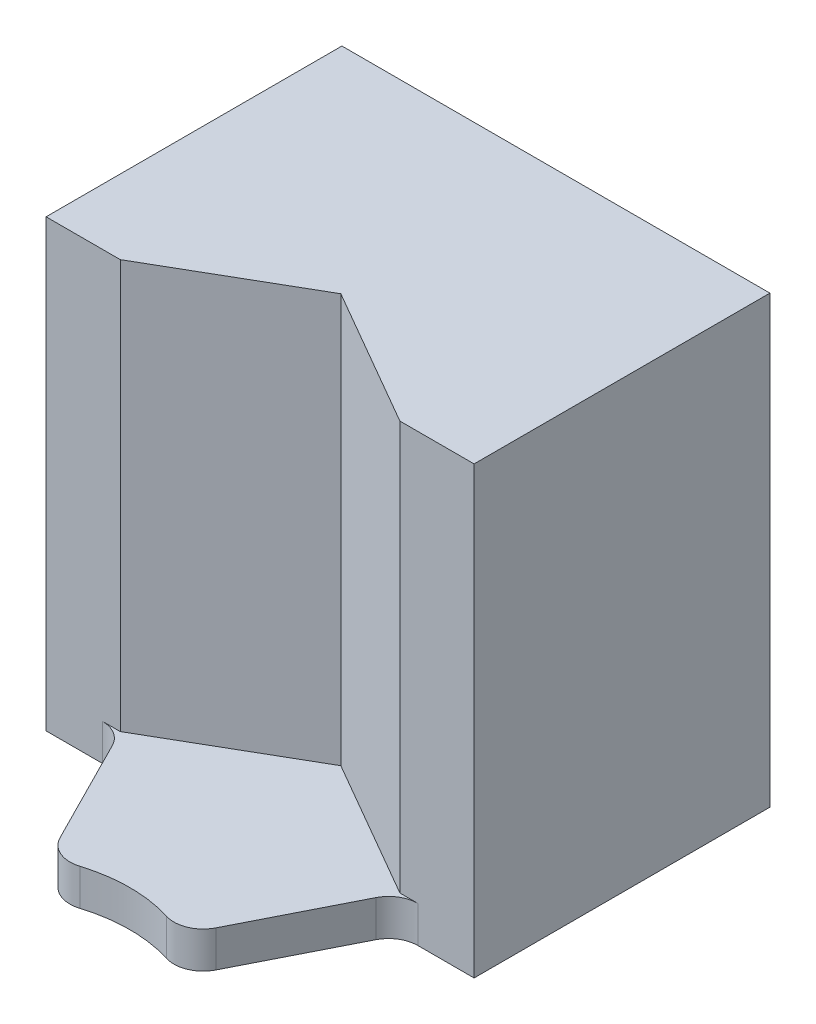
from build123d import *

# Parameters (mm, degrees)
BOSS_EXTRUDE1_DEPTH = 140
BOSS_EXTRUDE2_DEPTH = 12.5
FILLET1_R           = 10


with BuildPart() as part:
    # Sketch1 → Boss-Extrude1 (new body)
    with BuildSketch(Plane(origin=(0, 0, 0), x_dir=(1, 0, 0), z_dir=(0, 1, 0))):
        Polygon((0, 0), (47.891204829, -27.65), (73.3, -27.65), (73.3, 73.672860643), (-73.3, 73.672860643), (-73.3, -27.65), (-47.891204829, -27.65), align=None)
    extrude(amount=BOSS_EXTRUDE1_DEPTH)

    # Sketch3 → Boss-Extrude2 (add)
    with BuildSketch(Plane.XZ):
        with BuildLine():
            Line((-47.891204829, 27.65), (-22.581478328, 77.65))
            ThreePointArc((-22.581478328, 77.65), (0, 72.260277252), (22.581478328, 77.65))
            Line((22.581478328, 77.65), (47.891204829, 27.65))
            Line((47.891204829, 27.65), (73.3, 27.65))
            Line((73.3, 27.65), (73.3, -73.672860643))
            Line((73.3, -73.672860643), (-73.3, -73.672860643))
            Line((-73.3, -73.672860643), (-73.3, 27.65))
            Line((-73.3, 27.65), (-47.891204829, 27.65))
        make_face()
    extrude(amount=BOSS_EXTRUDE2_DEPTH)

    # Fillet1
    fillet1_edges = [part.edges().sort_by_distance(p)[0] for p in [
        (-47.891204829, -6.25, 27.65),
        (47.891204829, -6.25, 27.65),
        (22.581478328, -6.25, 77.65),
        (-22.581478328, -6.25, 77.65),
    ]]
    fillet(fillet1_edges, radius=FILLET1_R)


solid = part.part
